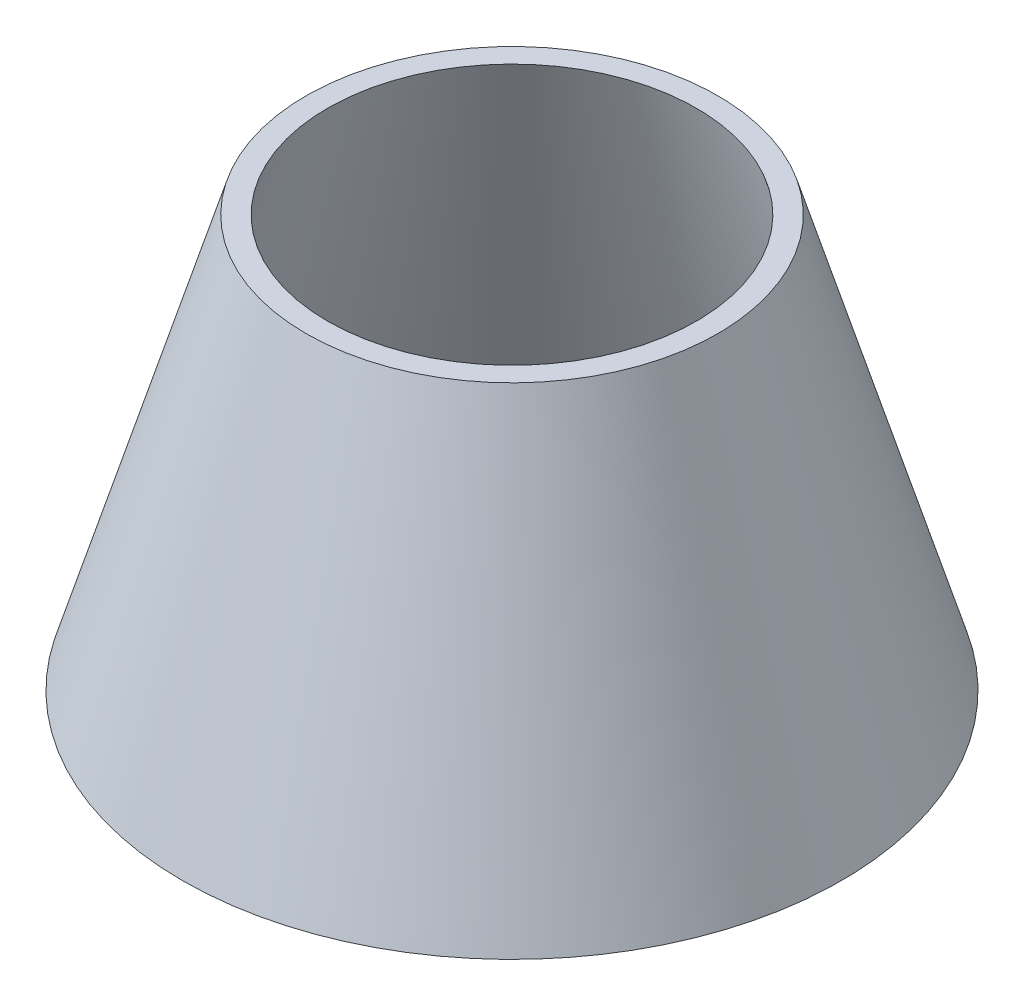
from build123d import *

# Parameters (mm, degrees)
SKETCH2_R = 31.75
SKETCH1_R = 50.8
SHELL1_T  = -3.175


with BuildPart() as part:
    # Sketch2 → Loft1 section 0
    with BuildSketch(Plane(origin=(0, 63.5, 0), x_dir=(1, 0, 0), z_dir=(0, 1, 0))):
        Circle(SKETCH2_R)
    # Sketch1 → Loft1 section 1
    with BuildSketch(Plane(origin=(0, 0, 0), x_dir=(1, 0, 0), z_dir=(0, 1, 0))):
        Circle(SKETCH1_R)
    loft()

    # Shell1
    shell1_openings = [part.faces().sort_by_distance(p)[0] for p in [
        (0, 0, 0),
        (0, 63.5, 0),
    ]]
    offset(amount=SHELL1_T, openings=shell1_openings, kind=Kind.INTERSECTION)


solid = part.part
